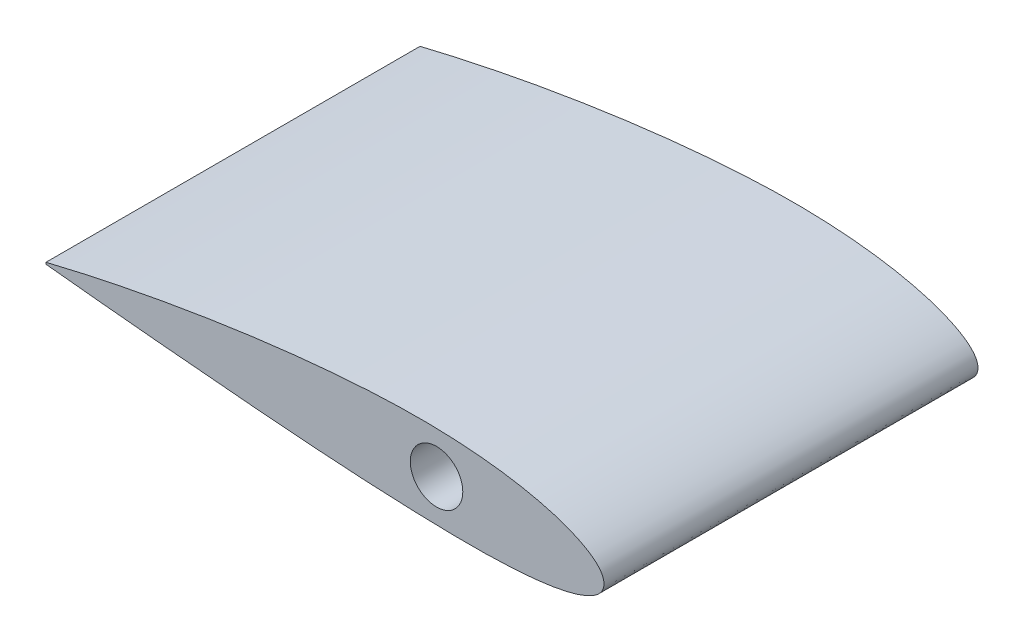
from build123d import *

# Parameters (mm, degrees)
BOSS_EXTRUDE1_DEPTH = 80
SKETCH2_R           = 11.2275
CUT_EXTRUDE1_DEPTH  = 81


with BuildPart() as part:
    # Sketch1 → Boss-Extrude1 (new, symmetric)
    with BuildSketch(Plane.XY):
        with BuildLine():
            Line((-238.675, 0.381187438), (-238.675, -0.375080537))
            add(Edge.make_bspline(
                [(-238.675, 0.381187438), (-238.562115977, 0.408767052), (-238.08635023, 0.525005253), (-237.008061317, 0.787162185), (-235.203893788, 1.222163618), (-232.692417394, 1.819938119), (-229.487989986, 2.569844813), (-225.608999635, 3.458736047), (-221.077844804, 4.471476375), (-215.920852717, 5.591318416), (-210.168186319, 6.8003277), (-203.853716701, 8.079746569), (-197.014866763, 9.41030561), (-189.692424094, 10.772461196), (-181.930325645, 12.146560271), (-173.775416798, 13.512939412), (-165.277188298, 14.851975719), (-156.487494334, 16.144112368), (-147.460254499, 17.369891123), (-138.251141533, 18.510004089), (-128.917254842, 19.545453741), (-119.516781793, 20.457599943), (-110.108636298, 21.229011884), (-100.738687987, 21.842612784), (-91.448634236, 22.288154874), (-82.295790206, 22.49596991), (-73.35483257, 22.463928995), (-64.702828584, 22.187114624), (-56.397940476, 21.667769112), (-48.495875722, 20.912185856), (-41.049350171, 19.931395959), (-34.10749814, 18.740733947), (-27.715339735, 17.359414779), (-21.913282389, 15.809833244), (-16.73665061, 14.116648387), (-12.215187057, 12.305641332), (-8.372488395, 10.402139974), (-5.225239405, 8.428904048), (-2.783157587, 6.401540541), (-1.052244784, 4.322610537), (-0.056660018, 2.172493692), (0.129841681, -0.013040918), (-0.485118951, -2.116648366), (-1.873876517, -4.027820142), (-3.951712439, -5.73405902), (-6.693728323, -7.267300245), (-10.088688623, -8.637294366), (-14.120806225, -9.844419373), (-18.768065608, -10.885539045), (-24.003355548, -11.757837546), (-29.795659026, -12.460153718), (-36.110844654, -12.993800718), (-42.912190191, -13.362969431), (-50.160721884, -13.574922495), (-57.815433259, -13.639960871), (-65.833426064, -13.571253014), (-74.169986794, -13.384258054), (-82.778692187, -13.096889482), (-91.628583695, -12.725343827), (-100.68307511, -12.294655582), (-109.886493142, -11.766197205), (-119.166555442, -11.162116198), (-128.453973845, -10.498190892), (-137.692556741, -9.79029231), (-146.826058416, -9.052613307), (-155.798543728, -8.298056153), (-164.554742094, -7.538004731), (-173.040409611, -6.782417814), (-181.202687582, -6.039967971), (-188.990455067, -5.318260373), (-196.354672515, -4.624083809), (-203.24871427, -3.963648854), (-209.628691852, -3.342831086), (-215.453758655, -2.767227265), (-220.686424685, -2.242558046), (-225.292785952, -1.773651888), (-229.242958682, -1.367494113), (-232.510834877, -1.02388031), (-235.075678546, -0.760955177), (-236.918777596, -0.548714441), (-238.031628616, -0.459131063), (-238.533564191, -0.37457711), (-238.666663293, -0.375050863), (-238.675, -0.375080537)],
                knots=[0, 0, 0, 0, 0.0007096, 0.002990709, 0.006776362, 0.012042422, 0.018755408, 0.02687278, 0.036343291, 0.047107376, 0.059097578, 0.072238997, 0.086449764, 0.101641523, 0.117719941, 0.134585245, 0.15213278, 0.170253622, 0.188835231, 0.207762166, 0.226916857, 0.246180448, 0.265433691, 0.284557902, 0.303518058, 0.322224105, 0.340457505, 0.358109579, 0.375076816, 0.391261793, 0.406574066, 0.420931083, 0.434259211, 0.446495009, 0.45758704, 0.467498677, 0.476212787, 0.483739999, 0.490133837, 0.495518475, 0.500133804, 0.504377282, 0.508620478, 0.513228901, 0.518586794, 0.524920689, 0.532343629, 0.540900414, 0.550595269, 0.561407005, 0.573297316, 0.586215471, 0.600101052, 0.6148856, 0.630493642, 0.646843383, 0.663847231, 0.681412269, 0.699440746, 0.717936233, 0.736765341, 0.755733017, 0.77472433, 0.793623237, 0.812313474, 0.830679418, 0.848606918, 0.86598408, 0.882702007, 0.898655501, 0.913743722, 0.927870829, 0.940946586, 0.952886966, 0.963614737, 0.973060029, 0.981160903, 0.987863874, 0.993124411, 0.996907375, 0.999187387, 0.999949102, 1, 1, 1, 1], degree=3))
        make_face()
    extrude(amount=BOSS_EXTRUDE1_DEPTH, both=True)

    # Sketch2 → Cut-Extrude1 (cut, symmetric)
    with BuildSketch(Plane.XY):
        with Locations((-71.603, 4.475)):
            Circle(SKETCH2_R)
    extrude(amount=CUT_EXTRUDE1_DEPTH, both=True, mode=Mode.SUBTRACT)


solid = part.part
